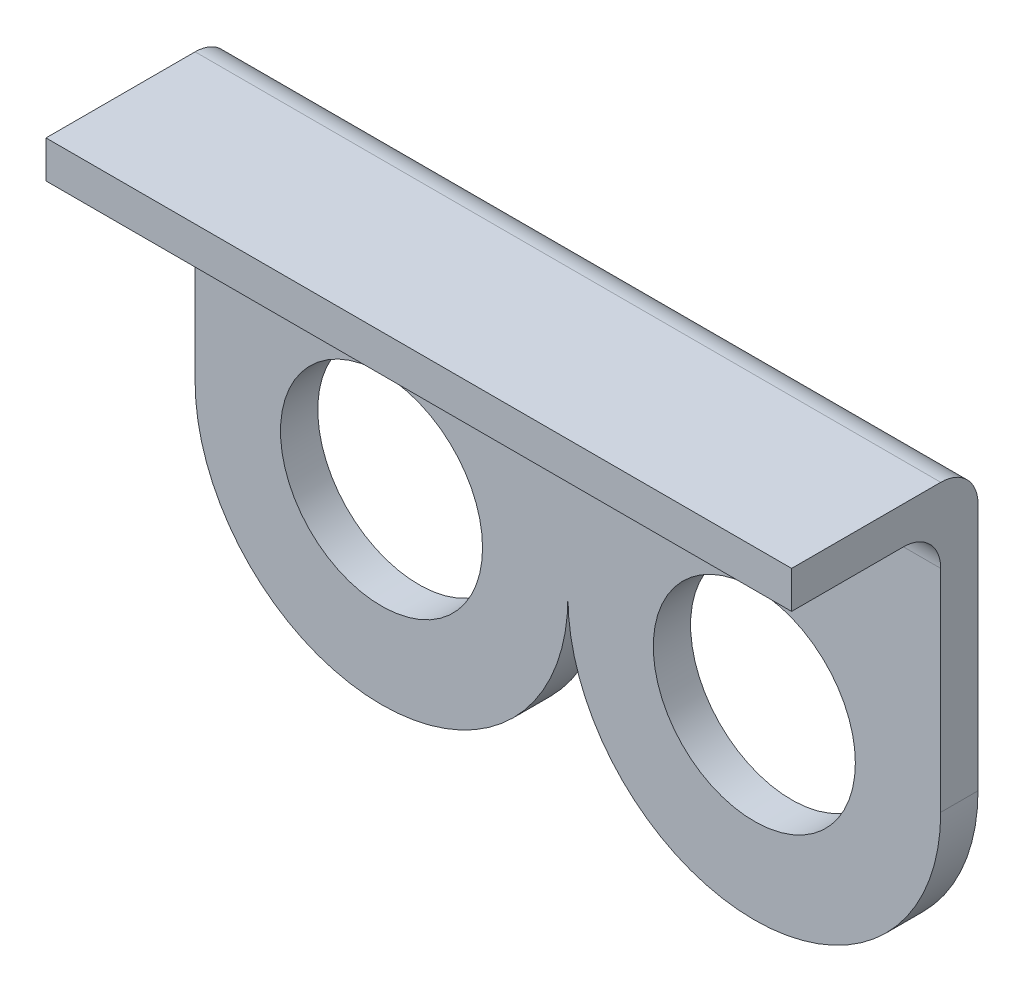
from build123d import *

# Parameters (mm, degrees)
SKETCH1_W           = 60
SKETCH1_H           = 3
BOSS_EXTRUDE2_DEPTH = 15
SKETCH1_5_R         = 8.13
BOSS_EXTRUDE3_DEPTH = 3
FILLET1_R           = 3
FILLET2_R           = 3


with BuildPart() as part:
    # Sketch1 → Boss-Extrude2 (new body)
    with BuildSketch(Plane.XY):
        with Locations((0, 19)):
            Rectangle(SKETCH1_W, SKETCH1_H)
    extrude(amount=BOSS_EXTRUDE2_DEPTH)

    # Sketch1<5> → Boss-Extrude3 (add)
    with BuildSketch(Plane.XY):
        with BuildLine():
            Line((30, 17.5), (-30, 17.5))
            Line((-30, 17.5), (-30, -2.5))
            ThreePointArc((-30, -2.5), (-25.606601718, -13.106601718), (-15, -17.5))
            ThreePointArc((-15, -17.5), (-4.393398282, -13.106601718), (0, -2.5))
            ThreePointArc((0, -2.5), (4.39339828, -13.106601715), (14.999999993, -17.5))
            ThreePointArc((14.999999993, -17.5), (25.606601715, -13.10660172), (30, -2.5))
            Line((30, -2.5), (30, 17.5))
        make_face()
        with Locations((-15, -2.5)):
            Circle(SKETCH1_5_R, mode=Mode.SUBTRACT)
        with Locations((15, -2.5)):
            Circle(SKETCH1_5_R, mode=Mode.SUBTRACT)
    extrude(amount=BOSS_EXTRUDE3_DEPTH)

    # Fillet1
    fillet1_edges = [part.edges().sort_by_distance(p)[0] for p in [
        (0, 17.5, 3),
    ]]
    fillet(fillet1_edges, radius=FILLET1_R)

    # Fillet2
    fillet2_edges = [part.edges().sort_by_distance(p)[0] for p in [
        (0, 20.5, 0),
    ]]
    fillet(fillet2_edges, radius=FILLET2_R)


solid = part.part
